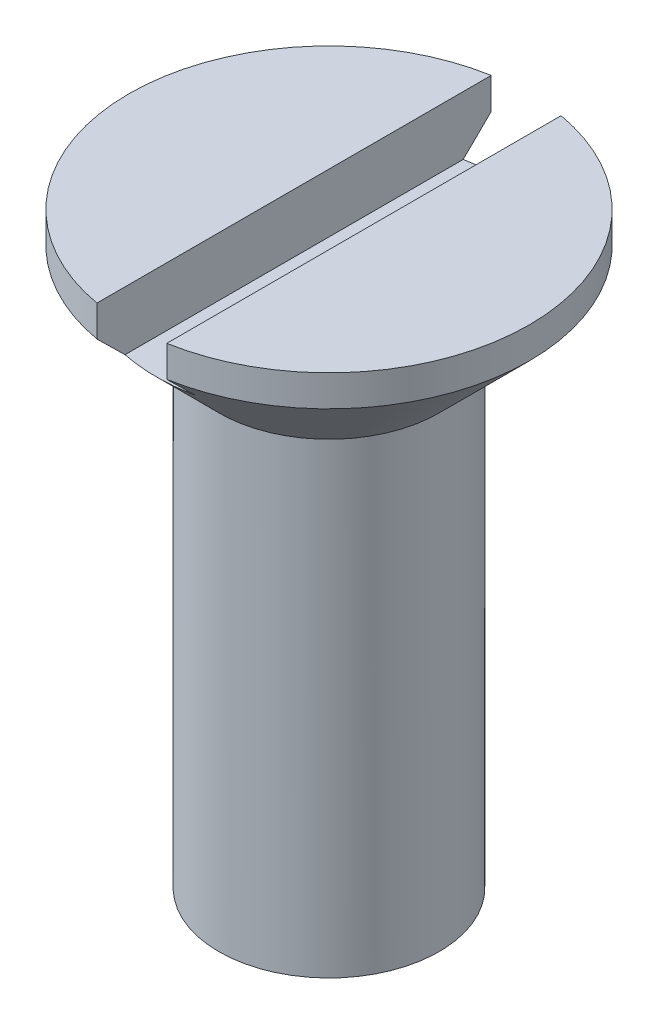
from build123d import *

# Parameters (mm, degrees)
SKETCH2_W          = 1.9
SKETCH2_H          = 10.9
CUT_EXTRUDE1_DEPTH = 1.6
SCALE1_SCALE       = 25.4
SCALE2_SCALE       = 0.03937008


with BuildPart() as part:
    # Sketch1 → Revolve1 (revolve)
    with BuildSketch(Plane.XY, mode=Mode.PRIVATE) as revolve1_sk:
        Polygon((0, 17.732050808), (5.45, 17.732050808), (5.45, 16.882050808), (3, 14.432050808), (3, 1.732050808), (0, 0), align=None)
    revolve(revolve1_sk.sketch.rotate(Axis((0, 0, 0), (0, 1, 0)), 90), axis=Axis((0, 0, 0), (0, 1, 0)))

    # Sketch2 → Cut-Extrude1 (cut)
    with BuildSketch(Plane(origin=(0, 17.732050808, 0), x_dir=(1, 0, 0), z_dir=(0, 1, 0))):
        Rectangle(SKETCH2_W, SKETCH2_H)
    extrude(amount=-CUT_EXTRUDE1_DEPTH, mode=Mode.SUBTRACT)


with BuildPart() as part_1:
    # Scale1: scaled about (0, 10.635932474, 0)
    add(part.part.scale(SCALE1_SCALE).moved(Location((0, -259.516752366, 0))))


with BuildPart() as part_2:
    # Scale2: scaled about (0, 10.635932474, 0)
    add(part_1.part.scale(SCALE2_SCALE).moved(Location((0, 10.217194962, 0))))


solid = part_2.part
